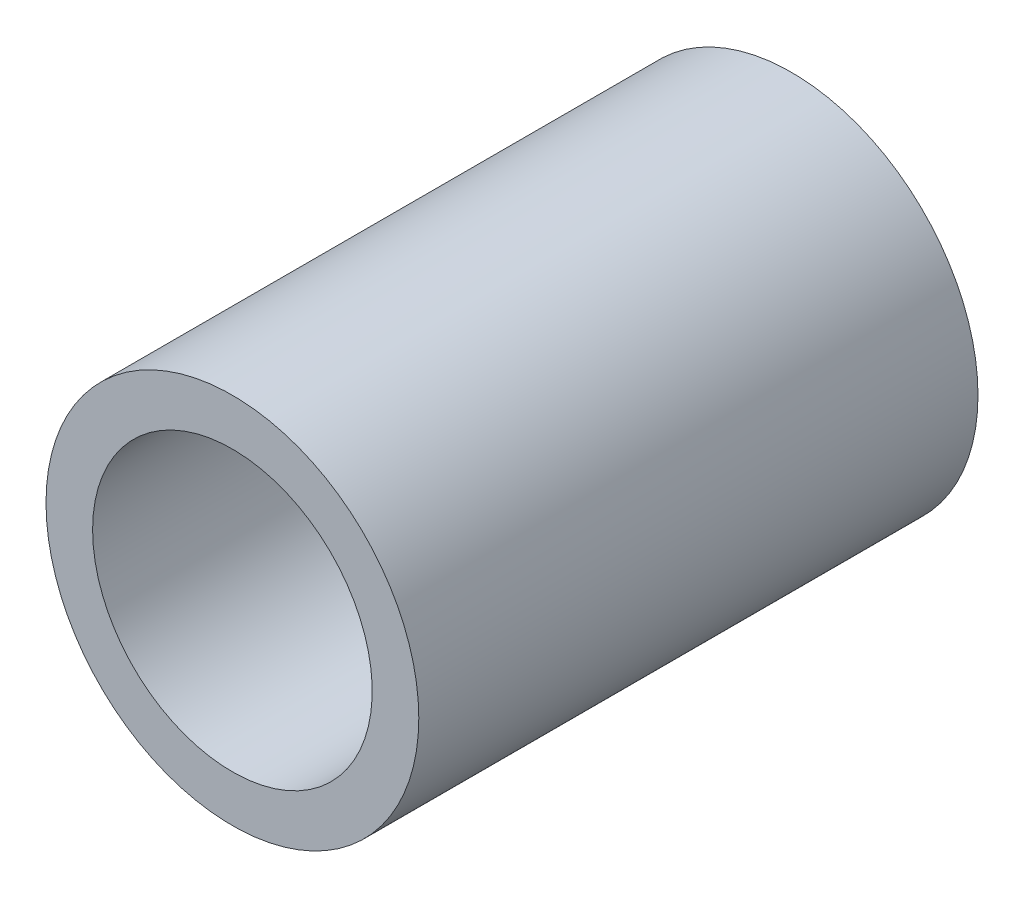
from build123d import *

# Parameters (mm, degrees)
SKETCH1_R           = 12.7
SKETCH1_R_2         = 9.525
BOSS_EXTRUDE1_DEPTH = 38.1


with BuildPart() as part:
    # Sketch1 → Boss-Extrude1 (new body)
    with BuildSketch(Plane.XY):
        with Locations(Location((0, 0, 0), (0, 0, 180))):
            Circle(SKETCH1_R)
        with Locations(Location((0, 0, 0), (0, 0, 180))):
            Circle(SKETCH1_R_2, mode=Mode.SUBTRACT)
    extrude(amount=BOSS_EXTRUDE1_DEPTH)


solid = part.part
